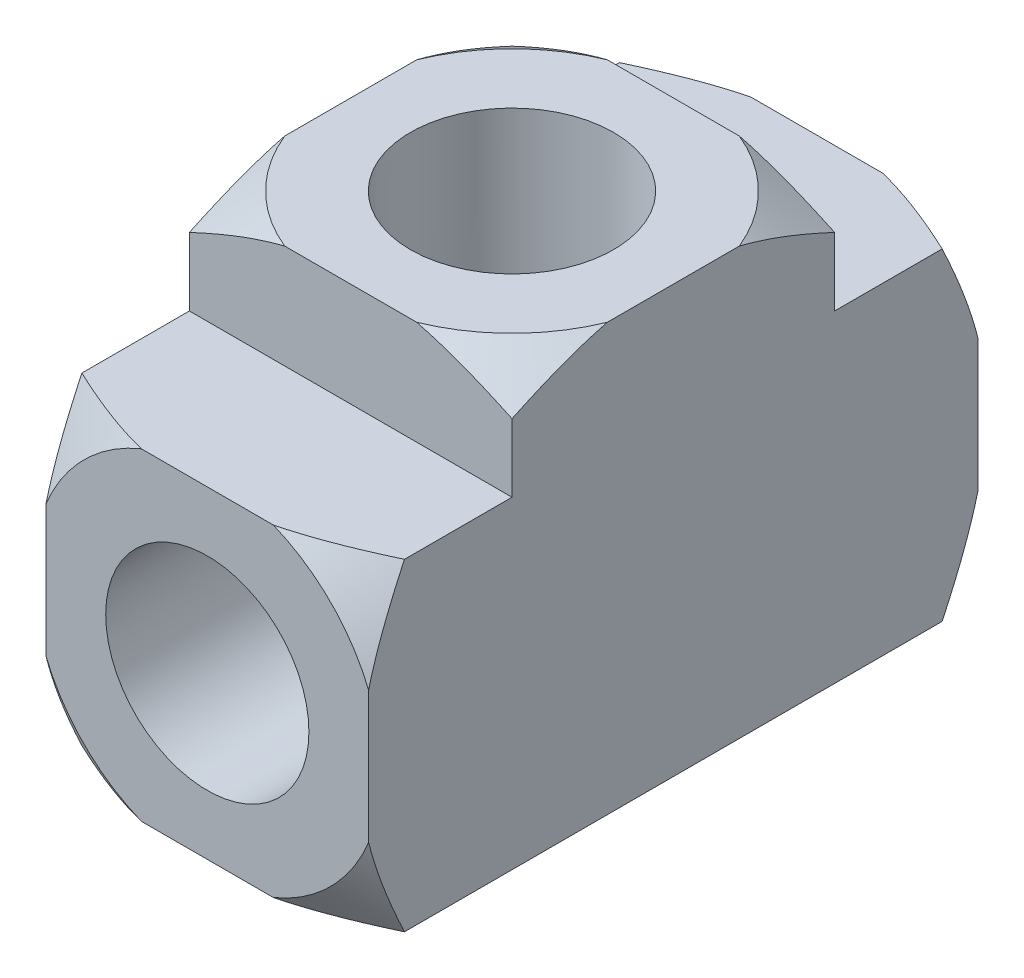
from build123d import *

# Parameters (mm, degrees)
BOSS_EXTRUDE1_DEPTH     = 7.14375
SKETCH2_R               = 4.5
CUT_EXTRUDE1_DEPTH      = 31.286531402
CUT_EXTRUDE2_REACH      = 26.287
CUT_EXTRUDE2_END_RADIUS = 4.5
SKETCH3_R               = 4.5


with BuildPart() as part:
    # Sketch1 → Boss-Extrude1 (new, symmetric)
    with BuildSketch(Plane(origin=(0, 0, 0), x_dir=(0, 0, -1), z_dir=(1, 0, 0))):
        Polygon((-13.49375, -7.14375), (13.49375, -7.14375), (13.49375, 7.14375), (7.14375, 7.14375), (7.14375, 11.74375), (-7.14375, 11.74375), (-7.14375, 7.14375), (-13.49375, 7.14375), align=None)
    extrude(amount=BOSS_EXTRUDE1_DEPTH, both=True)

    # Sketch2 → Cut-Extrude1 (cut, through all)
    with BuildSketch(Plane.XY.offset(13.49375)):
        Circle(SKETCH2_R)
    extrude(amount=-CUT_EXTRUDE1_DEPTH, mode=Mode.SUBTRACT)

    # Cut-Extrude2: up to this cylinder (the profile starts outside it)
    cut_extrude2_end = Plane(origin=(0, 0, 0), z_dir=(0, 0, 1)) * Cylinder(CUT_EXTRUDE2_END_RADIUS, 62.574, mode=Mode.PRIVATE)
    # Sketch3 → Cut-Extrude2 (cut, up to the surface)
    with BuildSketch(Plane(origin=(0, 11.74375, 0), x_dir=(1, 0, 0), z_dir=(0, 1, 0)), mode=Mode.PRIVATE) as cut_extrude2_sk1:
        with Locations(Location((0, 0, 0), (0, 0, 270))):
            Circle(SKETCH3_R)
    cut_extrude2_tool1 = extrude(cut_extrude2_sk1.sketch, amount=-CUT_EXTRUDE2_REACH, mode=Mode.PRIVATE) - cut_extrude2_end
    add(cut_extrude2_tool1.solids().sort_by_distance((0, 11.74375, 0))[0], mode=Mode.SUBTRACT)

    # Sketch4 → Cut-Revolve1 (revolve, cut)
    with BuildSketch(Plane(origin=(0, 0, 0), x_dir=(0, 0, -1), z_dir=(0.7071067811865476, 0.7071067811865475, 0))):
        Polygon((13.49375, 10.102788136), (13.99375, 6.967405384), (11.90625, 10.102788136), align=None)
        Polygon((-13.49375, 10.102788136), (-13.99375, 6.967405384), (-11.90625, 10.102788136), align=None)
    revolve(axis=Axis((0, 0, -13.49375), (0, 0, 1)), mode=Mode.SUBTRACT)

    # Sketch5 → Cut-Revolve2 (revolve, cut)
    with BuildSketch(Plane(origin=(0, 0, 0), x_dir=(-0.7071067811865476, 0, -0.7071067811865475), z_dir=(0.7071067811865475, 0, -0.7071067811865476))):
        Polygon((10.102788136, 11.74375), (6.967405384, 12.24375), (10.102788136, 10.15625), align=None)
    revolve(axis=Axis((0, 0, 0), (0, 1, 0)), mode=Mode.SUBTRACT)


solid = part.part
